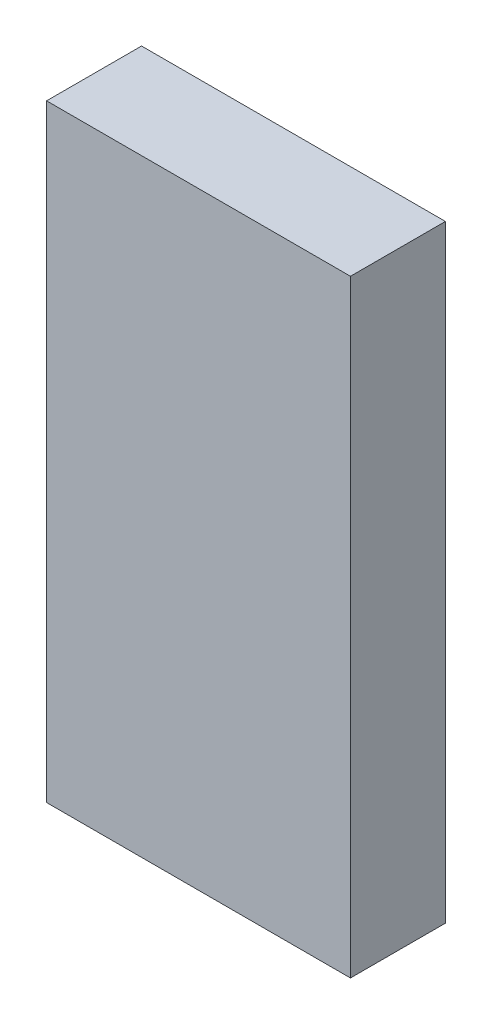
from build123d import *

# Parameters (mm, degrees)
SKETCH1_W           = 101.6
SKETCH1_H           = 203.2
BOSS_EXTRUDE1_DEPTH = 31.75


with BuildPart() as part:
    # Sketch1 → Boss-Extrude1 (new body)
    with BuildSketch(Plane.XY):
        with Locations((50.8, 101.6)):
            Rectangle(SKETCH1_W, SKETCH1_H)
    extrude(amount=BOSS_EXTRUDE1_DEPTH)


solid = part.part
